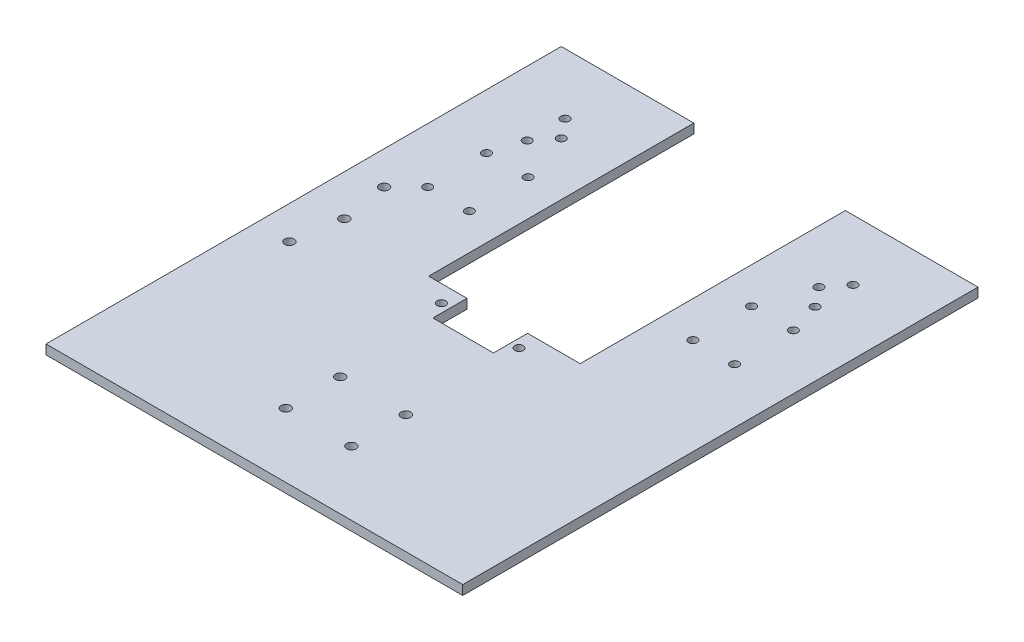
from build123d import *

# Parameters (mm, degrees)
SKETCH1_W           = 220
SKETCH1_H           = 272
SKETCH1_R           = 2.25
SKETCH1_R_2         = 2.235
SKETCH1_R_3         = 2.24
SKETCH1_R_4         = 2.5
SKETCH1_W_2         = 32
SKETCH1_H_2         = 18
BOSS_EXTRUDE1_DEPTH = 5
CUT_EXTRUDE1_DEPTH  = 175.988571055


with BuildPart() as part:
    # Sketch1 → Boss-Extrude1 (new body)
    with BuildSketch(Plane(origin=(0, 0, 0), x_dir=(1, 0, 0), z_dir=(0, 1, 0))):
        Rectangle(SKETCH1_W, SKETCH1_H)
        with Locations(Location((68, 94, 0), (0, 0, 270))):
            Circle(SKETCH1_R, mode=Mode.SUBTRACT)
        with Locations(Location((76, 104, 0), (0, 0, 270))):
            Circle(SKETCH1_R_2, mode=Mode.SUBTRACT)
        with Locations(Location((76, 84, 0), (0, 0, 270))):
            Circle(SKETCH1_R_3, mode=Mode.SUBTRACT)
        with Locations(Location((-76, 84, 0), (0, 0, 270))):
            Circle(SKETCH1_R, mode=Mode.SUBTRACT)
        with Locations(Location((-68, 94, 0), (0, 0, 270))):
            Circle(SKETCH1_R, mode=Mode.SUBTRACT)
        with Locations(Location((-76, 104, 0), (0, 0, 270))):
            Circle(SKETCH1_R, mode=Mode.SUBTRACT)
        with Locations(Location((-81, 67.5, 0), (0, 0, 270))):
            Circle(SKETCH1_R, mode=Mode.SUBTRACT)
        with Locations(Location((-81, 36.5, 0), (0, 0, 270))):
            Circle(SKETCH1_R, mode=Mode.SUBTRACT)
        with Locations(Location((-59, 67.5, 0), (0, 0, 270))):
            Circle(SKETCH1_R, mode=Mode.SUBTRACT)
        with Locations(Location((-59, 36.5, 0), (0, 0, 270))):
            Circle(SKETCH1_R, mode=Mode.SUBTRACT)
        with Locations(Location((59, 36.5, 0), (0, 0, 270))):
            Circle(SKETCH1_R, mode=Mode.SUBTRACT)
        with Locations(Location((59, 67.5, 0), (0, 0, 270))):
            Circle(SKETCH1_R, mode=Mode.SUBTRACT)
        with Locations(Location((81, 67.5, 0), (0, 0, 270))):
            Circle(SKETCH1_R, mode=Mode.SUBTRACT)
        with Locations(Location((81, 36.5, 0), (0, 0, 270))):
            Circle(SKETCH1_R, mode=Mode.SUBTRACT)
        with Locations(Location((-24.269619723, -13, 0), (0, 0, 270))):
            Circle(SKETCH1_R, mode=Mode.SUBTRACT)
        with Locations(Location((16.730380277, -13, 0), (0, 0, 270))):
            Circle(SKETCH1_R, mode=Mode.SUBTRACT)
        with Locations(Location((-17.315138118, -102.104616257, 0), (0, 0, 270))):
            Circle(SKETCH1_R_4, mode=Mode.SUBTRACT)
        with Locations(Location((17.315138118, -102.104616257, 0), (0, 0, 270))):
            Circle(SKETCH1_R_4, mode=Mode.SUBTRACT)
        with Locations(Location((17.315138118, -73.368855125, 0), (0, 0, 270))):
            Circle(SKETCH1_R_4, mode=Mode.SUBTRACT)
        with Locations(Location((-17.315138118, -73.368855125, 0), (0, 0, 270))):
            Circle(SKETCH1_R_4, mode=Mode.SUBTRACT)
        with Locations(Location((-88.5, 0, 0), (0, 0, 270))):
            Circle(SKETCH1_R_4, mode=Mode.SUBTRACT)
        with Locations(Location((-92.5, 25, 0), (0, 0, 270))):
            Circle(SKETCH1_R_4, mode=Mode.SUBTRACT)
        with Locations(Location((-92.5, -25, 0), (0, 0, 270))):
            Circle(SKETCH1_R_4, mode=Mode.SUBTRACT)
        with Locations((-3.769619723, -13)):
            Rectangle(SKETCH1_W_2, SKETCH1_H_2, mode=Mode.SUBTRACT)
    extrude(amount=BOSS_EXTRUDE1_DEPTH)

    # Sketch3 → Cut-Extrude1 (cut, through all)
    with BuildSketch(Plane(origin=(0, 5, 0), x_dir=(1, 0, 0), z_dir=(0, 1, 0))):
        Polygon((0, 136), (40, 136), (40, -4), (-40, -4), (-40, 136), align=None)
    extrude(amount=-CUT_EXTRUDE1_DEPTH, mode=Mode.SUBTRACT)


solid = part.part
